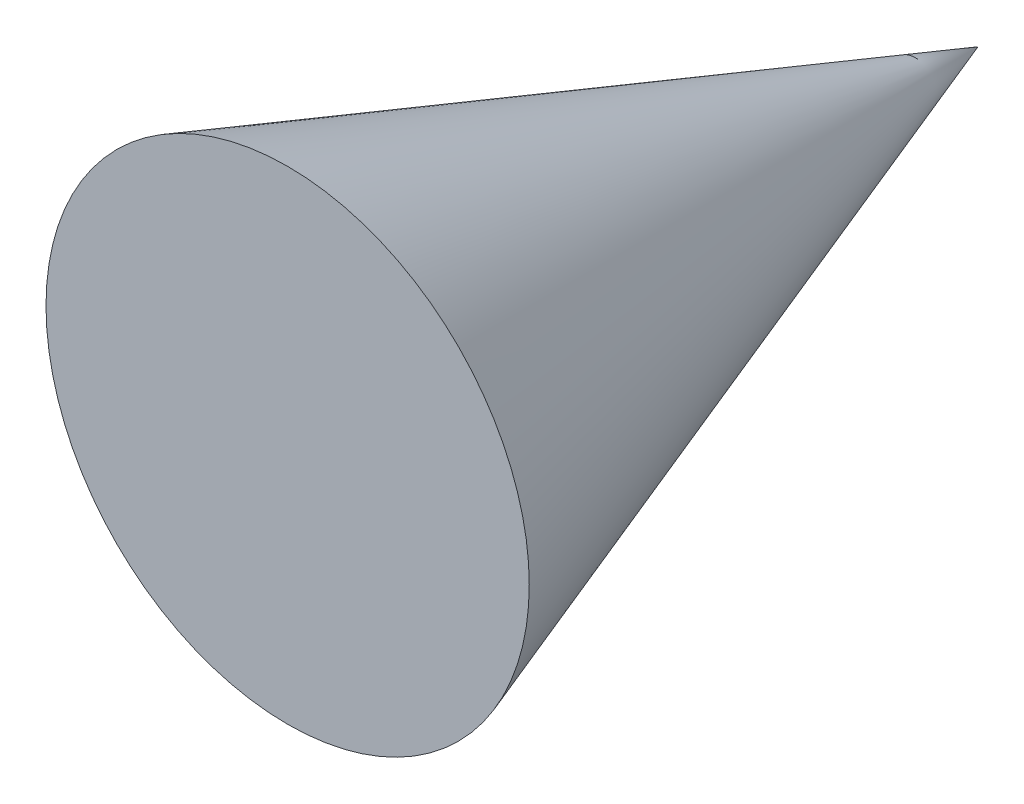
from build123d import *


with BuildPart() as part:
    # Sketch1 → Revolve1 (revolve)
    with BuildSketch(Plane(origin=(0, 0, 0), x_dir=(1, 0, 0), z_dir=(0, 1, 0))):
        Polygon((0, 0), (0, -20), (7, -20), align=None)
    revolve(axis=Axis((0, 0, 0), (0, 0, 1)))


solid = part.part
